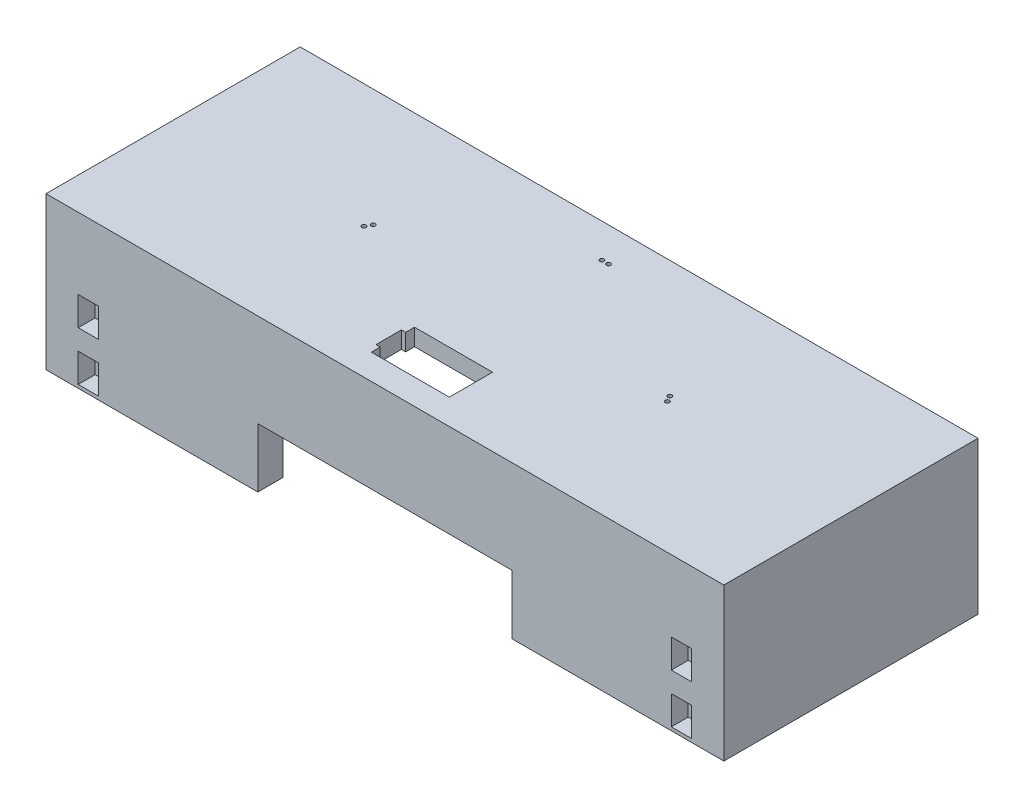
from build123d import *

# Parameters (mm, degrees)
SKETCH1_W                 = 200
SKETCH1_H                 = 75
BOSS_EXTRUDE1_DEPTH       = 22.5
SHELL1_T                  = -5
SKETCH2_W                 = 23
SKETCH2_H                 = 12.75
CUT_EXTRUDE1_DEPTH        = 116.893269865
SKETCH4_W                 = 190
SKETCH4_H                 = 40
BOSS_EXTRUDE2_DEPTH       = 2.5
SKETCH5_W                 = 6
SKETCH5_H                 = 8.5
SKETCH5_W_2               = 5
SKETCH5_H_2               = 7.5
CUT_EXTRUDE2_DEPTH        = 5
F_1_0MM_DOWEL_HOLE1_D     = 15
F_1_0MM_DOWEL_HOLE1_DEPTH = 5
F_1_0MM_DOWEL_HOLE1_TIP   = 4.506454643
SKETCH9_W                 = 75
SKETCH9_H                 = 17.5
CUT_EXTRUDE3_DEPTH        = 7.5
SKETCH10_W                = 2.5
SKETCH10_H                = 7.5
CUT_EXTRUDE4_DEPTH        = 5
F_1_0MM_DOWEL_HOLE2_D     = 1.25
F_1_0MM_DOWEL_HOLE2_DEPTH = 5
F_1_0MM_DOWEL_HOLE2_TIP   = 0.375537887


with BuildPart() as part:
    # Sketch1 → Boss-Extrude1 (new, symmetric)
    with BuildSketch(Plane(origin=(0, 0, 0), x_dir=(1, 0, 0), z_dir=(0, 1, 0))):
        Rectangle(SKETCH1_W, SKETCH1_H)
    extrude(amount=BOSS_EXTRUDE1_DEPTH, both=True)

    # Shell1
    shell1_openings = [part.faces().sort_by_distance(p)[0] for p in [
        (0, -22.5, 0),
    ]]
    offset(amount=SHELL1_T, openings=shell1_openings, kind=Kind.INTERSECTION)

    # Sketch2 → Cut-Extrude1 (cut, through all)
    with BuildSketch(Plane(origin=(0, 22.5, 0), x_dir=(1, 0, 0), z_dir=(0, 1, 0))):
        with Locations((0, -23.625)):
            Rectangle(SKETCH2_W, SKETCH2_H)
    extrude(amount=-CUT_EXTRUDE1_DEPTH, mode=Mode.SUBTRACT)

    # Sketch4 → Boss-Extrude2 (add)
    with BuildSketch(Plane(origin=(0, 0, 32.5), x_dir=(-1, 0, 0), z_dir=(0, 0, -1))):
        with Locations((0, -2.5)):
            Rectangle(SKETCH4_W, SKETCH4_H)
    extrude(amount=BOSS_EXTRUDE2_DEPTH)

    # Sketch5 → Cut-Extrude2 (cut)
    # profile 1 of 8: a face of its own
    with BuildSketch(Plane.XY.offset(37.5)):
        with Locations((-87.5, -2.75)):
            Rectangle(SKETCH5_W, SKETCH5_H)
        with Locations((-87.5, -2.75)):
            Rectangle(SKETCH5_W_2, SKETCH5_H_2, mode=Mode.SUBTRACT)
    # profile 2 of 8: a face of its own
    with BuildSketch(Plane.XY.offset(37.5)):
        with Locations((-87.5, -2.75)):
            Rectangle(SKETCH5_W_2, SKETCH5_H_2)
    # profile 3 of 8: a face of its own
    with BuildSketch(Plane.XY.offset(37.5)):
        with Locations((-87.5, -17.25)):
            Rectangle(SKETCH5_W, SKETCH5_H)
        with Locations((-87.5, -17.25)):
            Rectangle(SKETCH5_W_2, SKETCH5_H_2, mode=Mode.SUBTRACT)
    # profile 4 of 8: a face of its own
    with BuildSketch(Plane.XY.offset(37.5)):
        with Locations((-87.5, -17.25)):
            Rectangle(SKETCH5_W_2, SKETCH5_H_2)
    # profile 5 of 8: a face of its own
    with BuildSketch(Plane.XY.offset(37.5)):
        with Locations((87.5, -2.75)):
            Rectangle(SKETCH5_W, SKETCH5_H)
        with Locations((87.5, -2.75)):
            Rectangle(SKETCH5_W_2, SKETCH5_H_2, mode=Mode.SUBTRACT)
    # profile 6 of 8: a face of its own
    with BuildSketch(Plane.XY.offset(37.5)):
        with Locations((87.5, -2.75)):
            Rectangle(SKETCH5_W_2, SKETCH5_H_2)
    # profile 7 of 8: a face of its own
    with BuildSketch(Plane.XY.offset(37.5)):
        with Locations((87.5, -17.25)):
            Rectangle(SKETCH5_W, SKETCH5_H)
        with Locations((87.5, -17.25)):
            Rectangle(SKETCH5_W_2, SKETCH5_H_2, mode=Mode.SUBTRACT)
    # profile 8 of 8: a face of its own
    with BuildSketch(Plane.XY.offset(37.5)):
        with Locations((87.5, -17.25)):
            Rectangle(SKETCH5_W_2, SKETCH5_H_2)
    extrude(amount=-CUT_EXTRUDE2_DEPTH, mode=Mode.SUBTRACT)

    # Ø1.0mm Dowel Hole1
    with Locations(Plane(origin=(0, 0, -37.5), x_dir=(-1, 0, 0), z_dir=(0, 0, -1))):
        with Locations((0, -22.5)):
            Hole(F_1_0MM_DOWEL_HOLE1_D / 2, depth=F_1_0MM_DOWEL_HOLE1_DEPTH)
            with Locations((0, 0, -(F_1_0MM_DOWEL_HOLE1_DEPTH + F_1_0MM_DOWEL_HOLE1_TIP / 2))):  # 118° drill point
                Cone(0, F_1_0MM_DOWEL_HOLE1_D / 2, F_1_0MM_DOWEL_HOLE1_TIP, mode=Mode.SUBTRACT)

    # Sketch9 → Cut-Extrude3 (cut)
    with BuildSketch(Plane.XY.offset(37.5)):
        with Locations((0, -13.75)):
            Rectangle(SKETCH9_W, SKETCH9_H)
    extrude(amount=-CUT_EXTRUDE3_DEPTH, mode=Mode.SUBTRACT)

    # Sketch10 → Cut-Extrude4 (cut)
    with BuildSketch(Plane(origin=(0, 22.5, 0), x_dir=(1, 0, 0), z_dir=(0, 1, 0))):
        with Locations((-11.5, -23.625)):
            Rectangle(SKETCH10_W, SKETCH10_H)
    extrude(amount=-CUT_EXTRUDE4_DEPTH, mode=Mode.SUBTRACT)

    # Ø1.0mm Dowel Hole2
    with Locations(Plane(origin=(0, 22.5, 0), x_dir=(1, 0, 0), z_dir=(0, 1, 0))):
        with Locations((-0.999952175, 27.490220049), (1.000000001, 27.490219113), (-44.767078272, 1.066584153), (-43.767078272, 2.79863496), (43.767078272, 2.79863496), (44.76705517, 1.066626038)):
            Hole(F_1_0MM_DOWEL_HOLE2_D / 2, depth=F_1_0MM_DOWEL_HOLE2_DEPTH)
            with Locations((0, 0, -(F_1_0MM_DOWEL_HOLE2_DEPTH + F_1_0MM_DOWEL_HOLE2_TIP / 2))):  # 118° drill point
                Cone(0, F_1_0MM_DOWEL_HOLE2_D / 2, F_1_0MM_DOWEL_HOLE2_TIP, mode=Mode.SUBTRACT)


solid = part.part
